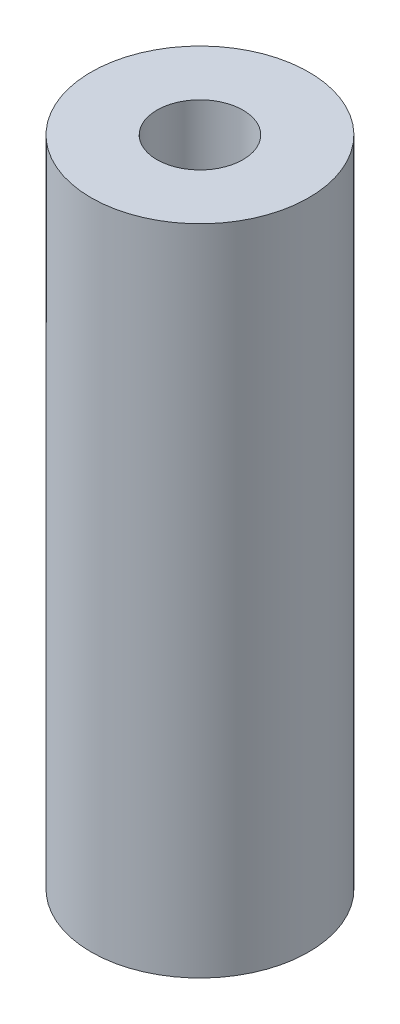
from build123d import *

# Parameters (mm, degrees)
SKETCH1_R           = 2
SKETCH1_R_2         = 0.79
BOSS_EXTRUDE1_DEPTH = 12


with BuildPart() as part:
    # Sketch1 → Boss-Extrude1 (new body)
    with BuildSketch(Plane(origin=(0, 0, 0), x_dir=(1, 0, 0), z_dir=(0, 1, 0))):
        with Locations(Location((0, 0, 0), (0, 0, 270))):
            Circle(SKETCH1_R)
        with Locations(Location((0, 0, 0), (0, 0, 270))):
            Circle(SKETCH1_R_2, mode=Mode.SUBTRACT)
    extrude(amount=BOSS_EXTRUDE1_DEPTH)


solid = part.part
